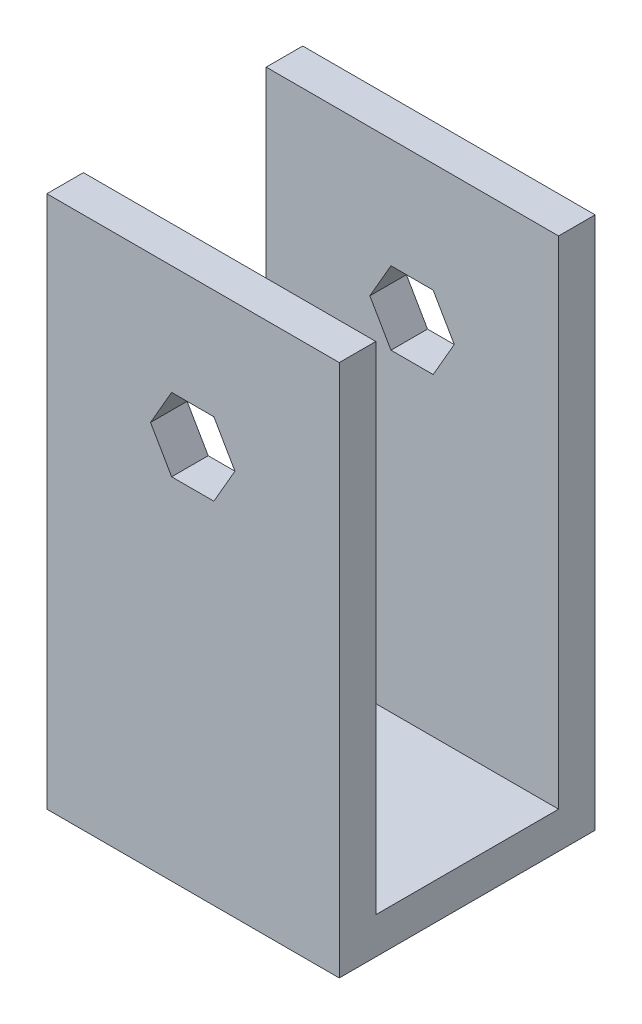
from build123d import *

# Parameters (mm, degrees)
SKETCH1_W           = 50.8
SKETCH1_H           = 86.242198053
BOSS_EXTRUDE1_DEPTH = 6.35
SKETCH1_3_W         = 50.8
SKETCH1_3_H         = 6.35
BOSS_EXTRUDE2_DEPTH = 38.1
SKETCH2_W           = 50.8
SKETCH2_H           = 92.592198053
BOSS_EXTRUDE4_DEPTH = 6.35


with BuildPart() as part:
    # Sketch1 → Boss-Extrude1 (new body)
    with BuildSketch(Plane.XY):
        with Locations((-965.320655189, 591.828631034)):
            Rectangle(SKETCH1_W, SKETCH1_H)
        Polygon((-969.04135584, 603.19973006), (-972.707530049, 609.54973006), (-969.04135584, 615.89973006), (-961.709007421, 615.89973006), (-958.042833212, 609.54973006), (-961.709007421, 603.19973006), align=None, mode=Mode.SUBTRACT)
    extrude(amount=BOSS_EXTRUDE1_DEPTH)

    # Sketch1<3> → Boss-Extrude2 (add)
    with BuildSketch(Plane.XY):
        with Locations((-965.320655189, 545.532532007)):
            Rectangle(SKETCH1_3_W, SKETCH1_3_H)
    extrude(amount=BOSS_EXTRUDE2_DEPTH)

    # Sketch2 → Boss-Extrude4 (add)
    with BuildSketch(Plane.XY.offset(38.1)):
        with Locations((-965.320655189, 588.653631034)):
            Rectangle(SKETCH2_W, SKETCH2_H)
        Polygon((-958.042833212, 609.54973006), (-961.709007421, 603.19973006), (-969.04135584, 603.19973006), (-972.707530049, 609.54973006), (-969.04135584, 615.89973006), (-961.709007421, 615.89973006), align=None, mode=Mode.SUBTRACT)
    extrude(amount=BOSS_EXTRUDE4_DEPTH)


solid = part.part
